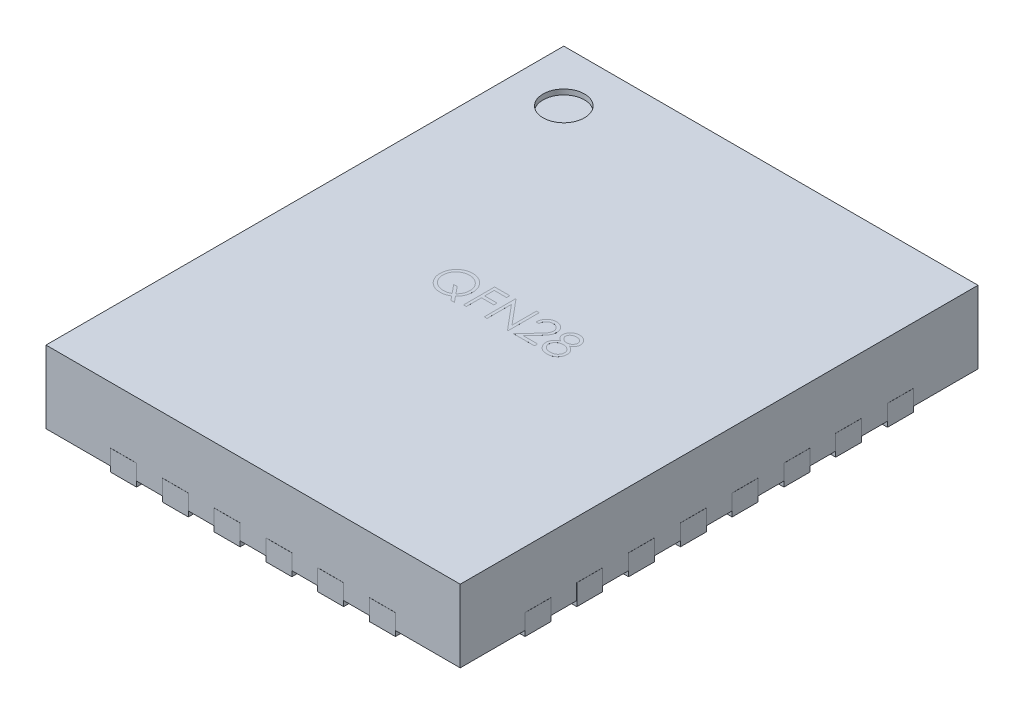
from build123d import *

# Parameters (mm, degrees)
SKETCH1_W                = 4
SKETCH1_H                = 5
BOSS_EXTRUDE1_DEPTH      = 0.7
SKETCH2_R                = 0.2
CUT_EXTRUDE1_DEPTH       = 0.05
BOSS_EXTRUDE2_DEPTH      = 0.05
BOSS_EXTRUDE2_DEPTH_BACK = 0.15
BOSS_EXTRUDE3_DEPTH      = 0.0001


with BuildPart() as part:
    # Sketch1 → Boss-Extrude1 (new body)
    with BuildSketch(Plane(origin=(0, 0, 0), x_dir=(1, 0, 0), z_dir=(0, 1, 0))):
        Rectangle(SKETCH1_W, SKETCH1_H)
    extrude(amount=BOSS_EXTRUDE1_DEPTH)

    # Sketch2 → Cut-Extrude1 (cut)
    with BuildSketch(Plane(origin=(0, 0.7, 0), x_dir=(1, 0, 0), z_dir=(0, 1, 0))):
        with Locations(Location((-1.5, 2, 0), (0, 0, 270))):
            Circle(SKETCH2_R)
    extrude(amount=-CUT_EXTRUDE1_DEPTH, mode=Mode.SUBTRACT)

    # Sketch3 → Boss-Extrude2 (add, two sides: drawn at the far end of the back side and taken through both)
    with BuildSketch(Plane.XZ.offset(-BOSS_EXTRUDE2_DEPTH_BACK)):
        Polygon((-1.325, -1.475), (-0.975, -1.825), (1.325, -1.825), (1.325, 1.825), (-1.325, 1.825), align=None)
        with BuildLine():
            Line((-1.375, 2.501), (-1.375, 2.225))
            ThreePointArc((-1.375, 2.225), (-1.338681241, 2.137318759), (-1.251, 2.101))
            Line((-1.251, 2.101), (-1.249, 2.101))
            ThreePointArc((-1.249, 2.101), (-1.161318759, 2.137318759), (-1.125, 2.225))
            Line((-1.125, 2.225), (-1.125, 2.501))
            Line((-1.125, 2.501), (-1.375, 2.501))
        make_face()
        with BuildLine():
            Line((-0.875, 2.501), (-0.875, 2.225))
            ThreePointArc((-0.875, 2.225), (-0.838681241, 2.137318759), (-0.751, 2.101))
            Line((-0.751, 2.101), (-0.749, 2.101))
            ThreePointArc((-0.749, 2.101), (-0.661318759, 2.137318759), (-0.625, 2.225))
            Line((-0.625, 2.225), (-0.625, 2.501))
            Line((-0.625, 2.501), (-0.875, 2.501))
        make_face()
        with BuildLine():
            Line((-0.375, 2.501), (-0.375, 2.225))
            ThreePointArc((-0.375, 2.225), (-0.338681241, 2.137318759), (-0.251, 2.101))
            Line((-0.251, 2.101), (-0.249, 2.101))
            ThreePointArc((-0.249, 2.101), (-0.161318759, 2.137318759), (-0.125, 2.225))
            Line((-0.125, 2.225), (-0.125, 2.501))
            Line((-0.125, 2.501), (-0.375, 2.501))
        make_face()
        with BuildLine():
            Line((0.125, 2.501), (0.125, 2.225))
            ThreePointArc((0.125, 2.225), (0.161318759, 2.137318759), (0.249, 2.101))
            Line((0.249, 2.101), (0.251, 2.101))
            ThreePointArc((0.251, 2.101), (0.338681241, 2.137318759), (0.375, 2.225))
            Line((0.375, 2.225), (0.375, 2.501))
            Line((0.375, 2.501), (0.125, 2.501))
        make_face()
        with BuildLine():
            Line((0.625, 2.501), (0.625, 2.225))
            ThreePointArc((0.625, 2.225), (0.661318759, 2.137318759), (0.749, 2.101))
            Line((0.749, 2.101), (0.751, 2.101))
            ThreePointArc((0.751, 2.101), (0.838681241, 2.137318759), (0.875, 2.225))
            Line((0.875, 2.225), (0.875, 2.501))
            Line((0.875, 2.501), (0.625, 2.501))
        make_face()
        with BuildLine():
            Line((1.125, 2.501), (1.125, 2.225))
            ThreePointArc((1.125, 2.225), (1.161318759, 2.137318759), (1.249, 2.101))
            Line((1.249, 2.101), (1.251, 2.101))
            ThreePointArc((1.251, 2.101), (1.338681241, 2.137318759), (1.375, 2.225))
            Line((1.375, 2.225), (1.375, 2.501))
            Line((1.375, 2.501), (1.125, 2.501))
        make_face()
        with BuildLine():
            Line((1.249, -2.101), (1.251, -2.101))
            ThreePointArc((1.251, -2.101), (1.338681241, -2.137318759), (1.375, -2.225))
            Line((1.375, -2.225), (1.375, -2.501))
            Line((1.375, -2.501), (1.125, -2.501))
            Line((1.125, -2.501), (1.125, -2.225))
            ThreePointArc((1.125, -2.225), (1.161318759, -2.137318759), (1.249, -2.101))
        make_face()
        with BuildLine():
            Line((0.749, -2.101), (0.751, -2.101))
            ThreePointArc((0.751, -2.101), (0.838681241, -2.137318759), (0.875, -2.225))
            Line((0.875, -2.225), (0.875, -2.501))
            Line((0.875, -2.501), (0.625, -2.501))
            Line((0.625, -2.501), (0.625, -2.225))
            ThreePointArc((0.625, -2.225), (0.661318759, -2.137318759), (0.749, -2.101))
        make_face()
        with BuildLine():
            Line((0.249, -2.101), (0.251, -2.101))
            ThreePointArc((0.251, -2.101), (0.338681241, -2.137318759), (0.375, -2.225))
            Line((0.375, -2.225), (0.375, -2.501))
            Line((0.375, -2.501), (0.125, -2.501))
            Line((0.125, -2.501), (0.125, -2.225))
            ThreePointArc((0.125, -2.225), (0.161318759, -2.137318759), (0.249, -2.101))
        make_face()
        with BuildLine():
            Line((-0.251, -2.101), (-0.249, -2.101))
            ThreePointArc((-0.249, -2.101), (-0.161318759, -2.137318759), (-0.125, -2.225))
            Line((-0.125, -2.225), (-0.125, -2.501))
            Line((-0.125, -2.501), (-0.375, -2.501))
            Line((-0.375, -2.501), (-0.375, -2.225))
            ThreePointArc((-0.375, -2.225), (-0.338681241, -2.137318759), (-0.251, -2.101))
        make_face()
        with BuildLine():
            Line((-0.751, -2.101), (-0.749, -2.101))
            ThreePointArc((-0.749, -2.101), (-0.661318759, -2.137318759), (-0.625, -2.225))
            Line((-0.625, -2.225), (-0.625, -2.501))
            Line((-0.625, -2.501), (-0.875, -2.501))
            Line((-0.875, -2.501), (-0.875, -2.225))
            ThreePointArc((-0.875, -2.225), (-0.838681241, -2.137318759), (-0.751, -2.101))
        make_face()
        with BuildLine():
            Line((-1.251, -2.101), (-1.249, -2.101))
            ThreePointArc((-1.249, -2.101), (-1.161318759, -2.137318759), (-1.125, -2.225))
            Line((-1.125, -2.225), (-1.125, -2.501))
            Line((-1.125, -2.501), (-1.375, -2.501))
            Line((-1.375, -2.501), (-1.375, -2.225))
            ThreePointArc((-1.375, -2.225), (-1.338681241, -2.137318759), (-1.251, -2.101))
        make_face()
        with BuildLine():
            Line((-2.001, -1.625), (-1.722861761, -1.625))
            ThreePointArc((-1.722861761, -1.625), (-1.636559546, -1.662066165), (-1.601, -1.749))
            Line((-1.601, -1.749), (-1.601, -1.751))
            ThreePointArc((-1.601, -1.751), (-1.637318759, -1.838681241), (-1.725, -1.875))
            Line((-1.725, -1.875), (-2.001, -1.875))
            Line((-2.001, -1.875), (-2.001, -1.625))
        make_face()
        with BuildLine():
            Line((-2.001, -1.125), (-1.722861761, -1.125))
            ThreePointArc((-1.722861761, -1.125), (-1.636559546, -1.162066165), (-1.601, -1.249))
            Line((-1.601, -1.249), (-1.601, -1.251))
            ThreePointArc((-1.601, -1.251), (-1.637318759, -1.338681241), (-1.725, -1.375))
            Line((-1.725, -1.375), (-2.001, -1.375))
            Line((-2.001, -1.375), (-2.001, -1.125))
        make_face()
        with BuildLine():
            Line((-2.001, -0.625), (-1.722861761, -0.625))
            ThreePointArc((-1.722861761, -0.625), (-1.636559546, -0.662066165), (-1.601, -0.749))
            Line((-1.601, -0.749), (-1.601, -0.751))
            ThreePointArc((-1.601, -0.751), (-1.637318759, -0.838681241), (-1.725, -0.875))
            Line((-1.725, -0.875), (-2.001, -0.875))
            Line((-2.001, -0.875), (-2.001, -0.625))
        make_face()
        with BuildLine():
            Line((-2.001, -0.125), (-1.722861761, -0.125))
            ThreePointArc((-1.722861761, -0.125), (-1.636559546, -0.162066165), (-1.601, -0.249))
            Line((-1.601, -0.249), (-1.601, -0.251))
            ThreePointArc((-1.601, -0.251), (-1.637318759, -0.338681241), (-1.725, -0.375))
            Line((-1.725, -0.375), (-2.001, -0.375))
            Line((-2.001, -0.375), (-2.001, -0.125))
        make_face()
        with BuildLine():
            Line((-2.001, 0.375), (-1.722861761, 0.375))
            ThreePointArc((-1.722861761, 0.375), (-1.636559546, 0.337933835), (-1.601, 0.251))
            Line((-1.601, 0.251), (-1.601, 0.249))
            ThreePointArc((-1.601, 0.249), (-1.637318759, 0.161318759), (-1.725, 0.125))
            Line((-1.725, 0.125), (-2.001, 0.125))
            Line((-2.001, 0.125), (-2.001, 0.375))
        make_face()
        with BuildLine():
            Line((-2.001, 0.875), (-1.722861761, 0.875))
            ThreePointArc((-1.722861761, 0.875), (-1.636559546, 0.837933835), (-1.601, 0.751))
            Line((-1.601, 0.751), (-1.601, 0.749))
            ThreePointArc((-1.601, 0.749), (-1.637318759, 0.661318759), (-1.725, 0.625))
            Line((-1.725, 0.625), (-2.001, 0.625))
            Line((-2.001, 0.625), (-2.001, 0.875))
        make_face()
        with BuildLine():
            Line((-2.001, 1.375), (-1.722861761, 1.375))
            ThreePointArc((-1.722861761, 1.375), (-1.636559546, 1.337933835), (-1.601, 1.251))
            Line((-1.601, 1.251), (-1.601, 1.249))
            ThreePointArc((-1.601, 1.249), (-1.637318759, 1.161318759), (-1.725, 1.125))
            Line((-1.725, 1.125), (-2.001, 1.125))
            Line((-2.001, 1.125), (-2.001, 1.375))
        make_face()
        with BuildLine():
            Line((-2.001, 1.875), (-1.722861761, 1.875))
            ThreePointArc((-1.722861761, 1.875), (-1.636559546, 1.837933835), (-1.601, 1.751))
            Line((-1.601, 1.751), (-1.601, 1.749))
            ThreePointArc((-1.601, 1.749), (-1.637318759, 1.661318759), (-1.725, 1.625))
            Line((-1.725, 1.625), (-2.001, 1.625))
            Line((-2.001, 1.625), (-2.001, 1.875))
        make_face()
        with BuildLine():
            Line((2.001, 1.625), (2.001, 1.875))
            Line((2.001, 1.875), (1.722861761, 1.875))
            ThreePointArc((1.722861761, 1.875), (1.636559546, 1.837933835), (1.601, 1.751))
            Line((1.601, 1.751), (1.601, 1.749))
            ThreePointArc((1.601, 1.749), (1.637318759, 1.661318759), (1.725, 1.625))
            Line((1.725, 1.625), (2.001, 1.625))
        make_face()
        with BuildLine():
            Line((2.001, 1.125), (2.001, 1.375))
            Line((2.001, 1.375), (1.722861761, 1.375))
            ThreePointArc((1.722861761, 1.375), (1.636559546, 1.337933835), (1.601, 1.251))
            Line((1.601, 1.251), (1.601, 1.249))
            ThreePointArc((1.601, 1.249), (1.637318759, 1.161318759), (1.725, 1.125))
            Line((1.725, 1.125), (2.001, 1.125))
        make_face()
        with BuildLine():
            Line((2.001, 0.625), (2.001, 0.875))
            Line((2.001, 0.875), (1.722861761, 0.875))
            ThreePointArc((1.722861761, 0.875), (1.636559546, 0.837933835), (1.601, 0.751))
            Line((1.601, 0.751), (1.601, 0.749))
            ThreePointArc((1.601, 0.749), (1.637318759, 0.661318759), (1.725, 0.625))
            Line((1.725, 0.625), (2.001, 0.625))
        make_face()
        with BuildLine():
            Line((2.001, 0.125), (2.001, 0.375))
            Line((2.001, 0.375), (1.722861761, 0.375))
            ThreePointArc((1.722861761, 0.375), (1.636559546, 0.337933835), (1.601, 0.251))
            Line((1.601, 0.251), (1.601, 0.249))
            ThreePointArc((1.601, 0.249), (1.637318759, 0.161318759), (1.725, 0.125))
            Line((1.725, 0.125), (2.001, 0.125))
        make_face()
        with BuildLine():
            Line((2.001, -0.375), (2.001, -0.125))
            Line((2.001, -0.125), (1.722861761, -0.125))
            ThreePointArc((1.722861761, -0.125), (1.636559546, -0.162066165), (1.601, -0.249))
            Line((1.601, -0.249), (1.601, -0.251))
            ThreePointArc((1.601, -0.251), (1.637318759, -0.338681241), (1.725, -0.375))
            Line((1.725, -0.375), (2.001, -0.375))
        make_face()
        with BuildLine():
            Line((2.001, -0.875), (2.001, -0.625))
            Line((2.001, -0.625), (1.722861761, -0.625))
            ThreePointArc((1.722861761, -0.625), (1.636559546, -0.662066165), (1.601, -0.749))
            Line((1.601, -0.749), (1.601, -0.751))
            ThreePointArc((1.601, -0.751), (1.637318759, -0.838681241), (1.725, -0.875))
            Line((1.725, -0.875), (2.001, -0.875))
        make_face()
        with BuildLine():
            Line((2.001, -1.375), (2.001, -1.125))
            Line((2.001, -1.125), (1.722861761, -1.125))
            ThreePointArc((1.722861761, -1.125), (1.636559546, -1.162066165), (1.601, -1.249))
            Line((1.601, -1.249), (1.601, -1.251))
            ThreePointArc((1.601, -1.251), (1.637318759, -1.338681241), (1.725, -1.375))
            Line((1.725, -1.375), (2.001, -1.375))
        make_face()
        with BuildLine():
            Line((2.001, -1.875), (2.001, -1.625))
            Line((2.001, -1.625), (1.722861761, -1.625))
            ThreePointArc((1.722861761, -1.625), (1.636559546, -1.662066165), (1.601, -1.749))
            Line((1.601, -1.749), (1.601, -1.751))
            ThreePointArc((1.601, -1.751), (1.637318759, -1.838681241), (1.725, -1.875))
            Line((1.725, -1.875), (2.001, -1.875))
        make_face()
    extrude(amount=BOSS_EXTRUDE2_DEPTH + BOSS_EXTRUDE2_DEPTH_BACK)

    # Sketch4 → Boss-Extrude3 (add)
    # profile 1 of 5: a face of its own
    with BuildSketch(Plane(origin=(0, 0.7, 0), x_dir=(1, 0, 0), z_dir=(0, 1, 0))):
        with BuildLine():
            Line((-0.431084232, -0.114831524), (-0.384990482, -0.171321908))
            Line((-0.384990482, -0.171321908), (-0.418584232, -0.171321908))
            Line((-0.418584232, -0.171321908), (-0.451877501, -0.130576716))
            add(Edge.make_bspline(
                [(-0.451877501, -0.130576716), (-0.45521668, -0.132605893), (-0.461833529, -0.136626869), (-0.472150669, -0.141809683), (-0.482672981, -0.146122461), (-0.493377181, -0.149685602), (-0.50424768, -0.152537687), (-0.515339601, -0.154517154), (-0.526612713, -0.155666606), (-0.534186633, -0.15584672), (-0.537995289, -0.155937293)],
                knots=[0, 0, 0, 0, 1.030216282, 2.041455142, 3.041201647, 4.026904037, 5.014869161, 6.002481075, 6.995518502, 8, 8, 8, 8], degree=3))
            add(Edge.make_bspline(
                [(-0.537995289, -0.155937293), (-0.54345189, -0.155805863), (-0.554188856, -0.155547249), (-0.569957723, -0.153289495), (-0.585093462, -0.149802594), (-0.599565903, -0.144757394), (-0.613390813, -0.138313181), (-0.626561768, -0.130368386), (-0.639085462, -0.121033053), (-0.650777027, -0.110368192), (-0.661467777, -0.098766309), (-0.67084824, -0.08637022), (-0.678824168, -0.073385623), (-0.685273181, -0.059747769), (-0.690391335, -0.045575385), (-0.693879218, -0.030750602), (-0.696136884, -0.015361672), (-0.696396973, -0.004883686), (-0.696528943, 0.000432899)],
                knots=[0, 0, 0, 0, 1.055750571, 2.07740284, 3.077223765, 4.05828044, 5.038417088, 6.02463293, 7.030503776, 8.057169806, 9.083586829, 10.080154041, 11.061747002, 12.027853603, 12.995569715, 13.972756451, 14.971366004, 16, 16, 16, 16], degree=3))
            add(Edge.make_bspline(
                [(-0.696528943, 0.000432899), (-0.69648199, 0.004001295), (-0.696388412, 0.011113015), (-0.695305914, 0.021646202), (-0.693697589, 0.032005984), (-0.691422676, 0.042149312), (-0.688444624, 0.052117762), (-0.684874249, 0.061891677), (-0.680548263, 0.071445872), (-0.675657842, 0.080760792), (-0.670203619, 0.089755706), (-0.66426221, 0.098302591), (-0.657818999, 0.106317218), (-0.650878547, 0.113795918), (-0.643468572, 0.120755224), (-0.635652794, 0.127309736), (-0.627264564, 0.133215617), (-0.618525275, 0.13870785), (-0.609385917, 0.143537508), (-0.600025256, 0.147855068), (-0.590373268, 0.151358224), (-0.58055519, 0.154343337), (-0.570511457, 0.156622301), (-0.560249895, 0.158218836), (-0.549777724, 0.159311776), (-0.54270564, 0.159401864), (-0.539137116, 0.159447322)],
                knots=[0, 0, 0, 0, 1.030721839, 2.054201982, 3.056261636, 4.058906239, 5.055198403, 6.060579377, 7.06322398, 8.083343201, 9.098870418, 10.10084648, 11.0888991, 12.067804703, 13.046436456, 14.024708667, 15.012489976, 16.008294399, 17.005242112, 17.997338632, 18.984424362, 19.969624474, 20.960977749, 21.957320355, 22.969278161, 24, 24, 24, 24], degree=3))
            add(Edge.make_bspline(
                [(-0.539137116, 0.159447322), (-0.533680495, 0.159316552), (-0.522963342, 0.159059712), (-0.50723354, 0.156801618), (-0.49214239, 0.153300724), (-0.477700637, 0.148281236), (-0.463921155, 0.141820794), (-0.450809735, 0.133877601), (-0.438346048, 0.12454165), (-0.426715575, 0.113876074), (-0.416050004, 0.102245602), (-0.406714038, 0.089781917), (-0.398770898, 0.076670489), (-0.392310258, 0.062891034), (-0.387291516, 0.048449182), (-0.383783279, 0.033339054), (-0.381535967, 0.017587604), (-0.381276295, 0.006850904), (-0.381144328, 0.001394438)],
                knots=[0, 0, 0, 0, 1.050672203, 2.063587442, 3.054842799, 4.031180399, 5.003107577, 5.981273811, 6.979214548, 7.998088659, 9.016962771, 10.014903508, 10.993069742, 11.96499692, 12.941334519, 13.932589877, 14.949327797, 16, 16, 16, 16], degree=3))
            add(Edge.make_bspline(
                [(-0.381144328, 0.001394438), (-0.381288552, -0.004283051), (-0.381572161, -0.015447511), (-0.383985724, -0.031819001), (-0.387866308, -0.047457632), (-0.393369446, -0.062353155), (-0.400483759, -0.076502864), (-0.409071805, -0.090048257), (-0.419236984, -0.102988373), (-0.42709356, -0.110842232), (-0.431084232, -0.114831524)],
                knots=[0, 0, 0, 0, 1.045660934, 2.056233022, 3.041853582, 4.009978652, 4.97562384, 5.954545411, 6.961031197, 8, 8, 8, 8], degree=3))
        make_face()
        with BuildLine():
            add(Edge.make_bspline(
                [(-0.449173174, -0.092656043), (-0.445899859, -0.089331788), (-0.439461102, -0.082792832), (-0.431106942, -0.072069289), (-0.423921526, -0.060922383), (-0.418168818, -0.049203834), (-0.413591755, -0.037060459), (-0.410429507, -0.024396038), (-0.4084495, -0.011268224), (-0.408195706, -0.002338565), (-0.408067405, 0.002175688)],
                knots=[0, 0, 0, 0, 1.052210109, 2.069743939, 3.061837814, 4.040478349, 5.010453814, 5.985306305, 6.981502329, 8, 8, 8, 8], degree=3))
            add(Edge.make_bspline(
                [(-0.408067405, 0.002175688), (-0.408100928, 0.005082811), (-0.408167198, 0.01082968), (-0.409078403, 0.019334039), (-0.410367487, 0.027650567), (-0.412233685, 0.035764407), (-0.41463689, 0.043659118), (-0.41760506, 0.051323984), (-0.421080363, 0.058783733), (-0.425131808, 0.065992023), (-0.429598183, 0.072938409), (-0.434569806, 0.079537938), (-0.439976699, 0.085756583), (-0.445759794, 0.091696822), (-0.45203059, 0.097236207), (-0.458766595, 0.102372362), (-0.465884809, 0.107229581), (-0.473420454, 0.111613848), (-0.481185935, 0.115644498), (-0.489135811, 0.119134791), (-0.497203331, 0.122090944), (-0.505376001, 0.124488004), (-0.513643247, 0.126374796), (-0.522019561, 0.127662438), (-0.530483283, 0.128572704), (-0.536169952, 0.128642933), (-0.539016924, 0.128678092)],
                knots=[0, 0, 0, 0, 1.032958288, 2.041976502, 3.037103433, 4.023477888, 4.998866292, 5.968231228, 6.943073582, 7.921783703, 8.90545537, 9.876780072, 10.85618943, 11.833110341, 12.821898168, 13.827467856, 14.842673888, 15.88323808, 16.924703457, 17.951432745, 18.967462636, 19.976958182, 20.977218729, 21.979378626, 22.98839684, 24, 24, 24, 24], degree=3))
            add(Edge.make_bspline(
                [(-0.539016924, 0.128678092), (-0.541883875, 0.128642687), (-0.547610413, 0.12857197), (-0.556114997, 0.127667472), (-0.564510535, 0.126373379), (-0.572760102, 0.124495964), (-0.580892913, 0.122094242), (-0.588883723, 0.119120217), (-0.596802026, 0.115716133), (-0.604483509, 0.111688057), (-0.611914733, 0.10726609), (-0.618982296, 0.102457167), (-0.625589344, 0.097213311), (-0.631798551, 0.091618947), (-0.637594407, 0.085630911), (-0.643004279, 0.079289033), (-0.647933159, 0.072519731), (-0.65244894, 0.065444116), (-0.656440202, 0.058054501), (-0.660039813, 0.050484213), (-0.662963497, 0.042649789), (-0.66536378, 0.034613938), (-0.667325174, 0.026396636), (-0.668589369, 0.017950182), (-0.669507409, 0.009327304), (-0.669572795, 0.003500348), (-0.669605866, 0.000553092)],
                knots=[0, 0, 0, 0, 1.013205451, 2.023808328, 3.020541854, 4.015386314, 5.012622987, 6.016502547, 7.02834558, 8.057881235, 9.080621846, 10.084476421, 11.077781791, 12.060654405, 13.037357686, 14.022218736, 15.005346502, 15.995617173, 16.98763393, 17.973029642, 18.956998942, 19.940662314, 20.93709383, 21.940823471, 22.958474994, 24, 24, 24, 24], degree=3))
            add(Edge.make_bspline(
                [(-0.669605866, 0.000553092), (-0.669493276, -0.003780015), (-0.669271775, -0.012304576), (-0.667435592, -0.024820104), (-0.664356999, -0.036801803), (-0.66004992, -0.048266815), (-0.654642974, -0.059281223), (-0.647919027, -0.069737121), (-0.639906766, -0.079594686), (-0.630909298, -0.088921624), (-0.621011949, -0.097371456), (-0.6105198, -0.104808232), (-0.599522429, -0.111117677), (-0.587985303, -0.116210135), (-0.575994454, -0.120299551), (-0.563455229, -0.123068168), (-0.550449594, -0.124903281), (-0.541587474, -0.125078975), (-0.537093847, -0.125168062)],
                knots=[0, 0, 0, 0, 1.022526523, 2.011626, 2.97850031, 3.937665323, 4.897797383, 5.869804095, 6.865337375, 7.89202157, 8.925035373, 9.93268082, 10.923937058, 11.912550332, 12.905497077, 13.90928476, 14.939882052, 16, 16, 16, 16], degree=3))
            add(Edge.make_bspline(
                [(-0.537093847, -0.125168062), (-0.534006555, -0.12513443), (-0.52790011, -0.125067909), (-0.518895481, -0.124160999), (-0.510111205, -0.122884504), (-0.501628626, -0.120943081), (-0.493374186, -0.118529464), (-0.48539702, -0.115593518), (-0.477654811, -0.112112929), (-0.472731976, -0.109359373), (-0.470266924, -0.107980562)],
                knots=[0, 0, 0, 0, 1.060694673, 2.097979151, 3.107774411, 4.11000626, 5.086069662, 6.061987343, 7.029562652, 8, 8, 8, 8], degree=3))
            Line((-0.470266924, -0.107980562), (-0.537815001, -0.025168062))
            Line((-0.537815001, -0.025168062), (-0.504221251, -0.025168062))
            Line((-0.504221251, -0.025168062), (-0.449173174, -0.092656043))
        make_face(mode=Mode.SUBTRACT)
    # profile 2 of 5: a face of its own
    with BuildSketch(Plane(origin=(0, 0.7, 0), x_dir=(1, 0, 0), z_dir=(0, 1, 0))):
        Polygon((-0.319605866, 0.151755015), (-0.17345202, 0.151755015), (-0.17345202, 0.120985784), (-0.292682789, 0.120985784), (-0.292682789, 0.028678092), (-0.17345202, 0.028678092), (-0.17345202, -0.002091139), (-0.292682789, -0.002091139), (-0.292682789, -0.148244985), (-0.319605866, -0.148244985), align=None)
    # profile 3 of 5: a face of its own
    with BuildSketch(Plane(origin=(0, 0.7, 0), x_dir=(1, 0, 0), z_dir=(0, 1, 0))):
        Polygon((-0.119605866, -0.148244985), (-0.119605866, 0.151755015), (-0.113956828, 0.151755015), (0.084240287, -0.084362774), (0.084240287, 0.151755015), (0.111163364, 0.151755015), (0.111163364, -0.148244985), (0.105033557, -0.148244985), (-0.092682789, 0.087331938), (-0.092682789, -0.148244985), align=None)
    # profile 4 of 5: a face of its own
    with BuildSketch(Plane(origin=(0, 0.7, 0), x_dir=(1, 0, 0), z_dir=(0, 1, 0))):
        with BuildLine():
            Line((0.199624903, 0.059447322), (0.172701826, 0.059447322))
            add(Edge.make_bspline(
                [(0.172701826, 0.059447322), (0.172877296, 0.063019113), (0.173221915, 0.070034014), (0.174835768, 0.080261777), (0.177144987, 0.090037903), (0.180409968, 0.099283896), (0.184464792, 0.108081508), (0.189327366, 0.116395795), (0.195086839, 0.124195039), (0.201618845, 0.13140694), (0.208713299, 0.138023018), (0.216368094, 0.143736324), (0.224411954, 0.148563553), (0.232820474, 0.152599088), (0.241688522, 0.155628218), (0.250935624, 0.157875787), (0.260602407, 0.159228045), (0.267188695, 0.159373398), (0.270538364, 0.159447322)],
                knots=[0, 0, 0, 0, 1.10065271, 2.161652631, 3.183658789, 4.190468796, 5.17591951, 6.163126047, 7.15150782, 8.156236427, 9.156009102, 10.134482811, 11.092018607, 12.041330605, 13.001268258, 13.972401359, 14.968799086, 16, 16, 16, 16], degree=3))
            add(Edge.make_bspline(
                [(0.270538364, 0.159447322), (0.273827914, 0.159370312), (0.28029176, 0.159218989), (0.289725647, 0.157919472), (0.298706558, 0.155884136), (0.307216938, 0.153028528), (0.315188887, 0.149189863), (0.32268229, 0.144578646), (0.32978636, 0.139245517), (0.336181227, 0.132966619), (0.342053348, 0.126263557), (0.347119256, 0.119107451), (0.351457527, 0.11171637), (0.355073614, 0.104033953), (0.357735568, 0.095987864), (0.359756558, 0.087695247), (0.360898907, 0.079070263), (0.361074229, 0.073232558), (0.361163364, 0.07026463)],
                knots=[0, 0, 0, 0, 1.111607364, 2.184268762, 3.212621178, 4.221274766, 5.211760367, 6.196651075, 7.1921475, 8.207485113, 9.220403448, 10.201281604, 11.166441695, 12.114753415, 13.065576456, 14.026450734, 14.996634279, 16, 16, 16, 16], degree=3))
            add(Edge.make_bspline(
                [(0.361163364, 0.07026463), (0.361018228, 0.066086244), (0.360730501, 0.057802797), (0.358269269, 0.045630095), (0.354425282, 0.033836373), (0.349796937, 0.024344604), (0.34512787, 0.016696019), (0.34092037, 0.010398702), (0.335994815, 0.003618233), (0.330279515, -0.003622682), (0.323892697, -0.011380759), (0.316776512, -0.019651313), (0.308880213, -0.028348893), (0.303338056, -0.034289374), (0.300466249, -0.037367582)],
                knots=[0, 0, 0, 0, 1.184426356, 2.348067706, 3.509069118, 4.696110526, 5.333549288, 6.050745305, 6.844228056, 7.710549037, 8.667450064, 9.695053472, 10.805634456, 12, 12, 12, 12], degree=3))
            Line((0.300466249, -0.037367582), (0.225406153, -0.117475755))
            Line((0.225406153, -0.117475755), (0.365009518, -0.117475755))
            Line((0.365009518, -0.117475755), (0.365009518, -0.148244985))
            Line((0.365009518, -0.148244985), (0.161163364, -0.148244985))
            Line((0.161163364, -0.148244985), (0.277509518, -0.024086332))
            add(Edge.make_bspline(
                [(0.277509518, -0.024086332), (0.280342194, -0.021129334), (0.285783185, -0.015449546), (0.293478835, -0.007157293), (0.300390748, 0.000535525), (0.306563667, 0.007614372), (0.311863682, 0.014182792), (0.316567016, 0.020028053), (0.320335495, 0.025407005), (0.324425386, 0.031641915), (0.328386585, 0.0392544), (0.331790501, 0.048557287), (0.33386606, 0.058133909), (0.334115045, 0.064605512), (0.334240287, 0.067860784)],
                knots=[0, 0, 0, 0, 1.329631726, 2.553950428, 3.673215718, 4.687767853, 5.603093632, 6.413772471, 7.123043292, 7.734684054, 8.834405432, 9.900288307, 10.943827018, 12, 12, 12, 12], degree=3))
            add(Edge.make_bspline(
                [(0.334240287, 0.067860784), (0.334185795, 0.069907761), (0.334078402, 0.073941959), (0.333130599, 0.079856739), (0.33169827, 0.085562294), (0.329645819, 0.091076176), (0.32693667, 0.096342946), (0.323638952, 0.101369016), (0.319834089, 0.10622807), (0.315432552, 0.110784067), (0.310597279, 0.114956742), (0.3054892, 0.118653092), (0.300084905, 0.121742159), (0.294407181, 0.124274458), (0.288471855, 0.12626092), (0.282267448, 0.127637369), (0.275811104, 0.128501582), (0.271402518, 0.128618511), (0.269156153, 0.128678092)],
                knots=[0, 0, 0, 0, 0.991446411, 1.95395049, 2.89581595, 3.838931463, 4.798493298, 5.75982156, 6.748411868, 7.785213223, 8.824556874, 9.840280684, 10.836137867, 11.835679398, 12.848801643, 13.863922112, 14.911575587, 16, 16, 16, 16], degree=3))
            add(Edge.make_bspline(
                [(0.269156153, 0.128678092), (0.266810081, 0.128616803), (0.262202785, 0.128496443), (0.255438296, 0.1276545), (0.248985229, 0.126201999), (0.242827352, 0.124215427), (0.236954245, 0.121690409), (0.23139447, 0.118545402), (0.226160508, 0.114792531), (0.22124252, 0.110537626), (0.216711322, 0.105800404), (0.212730161, 0.10051955), (0.209251531, 0.094791485), (0.206216454, 0.088631667), (0.20375168, 0.0819842), (0.201868268, 0.074872682), (0.200377966, 0.067327993), (0.199880093, 0.062117842), (0.199624903, 0.059447322)],
                knots=[0, 0, 0, 0, 1.031018746, 2.02475058, 2.990194455, 3.934040569, 4.864654155, 5.795059489, 6.735614925, 7.690564532, 8.649604399, 9.611025574, 10.590972636, 11.591080095, 12.624614302, 13.701020113, 14.821632451, 16, 16, 16, 16], degree=3))
        make_face()
    # profile 5 of 5: a face of its own
    with BuildSketch(Plane(origin=(0, 0.7, 0), x_dir=(1, 0, 0), z_dir=(0, 1, 0))):
        with BuildLine():
            add(Edge.make_bspline(
                [(0.537785961, 0.018882418), (0.54024155, 0.017602022), (0.54503077, 0.015104822), (0.551851674, 0.011083894), (0.558085245, 0.006846097), (0.563904437, 0.002591595), (0.569207009, -0.001842547), (0.573933673, -0.00647396), (0.578201184, -0.011187041), (0.581923479, -0.016061599), (0.585197494, -0.021084683), (0.588027106, -0.026269478), (0.590445723, -0.031604621), (0.592362546, -0.037148349), (0.593941557, -0.042819229), (0.595028037, -0.048690484), (0.595612345, -0.054723428), (0.595722814, -0.058800711), (0.595778749, -0.060865178)],
                knots=[0, 0, 0, 0, 1.272397273, 2.481599622, 3.635517121, 4.734568067, 5.792894095, 6.808321871, 7.773003508, 8.711915296, 9.623354172, 10.525449501, 11.423591555, 12.311487226, 13.218079475, 14.126165749, 15.051214107, 16, 16, 16, 16], degree=3))
            add(Edge.make_bspline(
                [(0.595778749, -0.060865178), (0.595712627, -0.063753555), (0.595581747, -0.069470737), (0.594441749, -0.077908975), (0.592734922, -0.08610427), (0.590242392, -0.094054827), (0.587009816, -0.101716773), (0.583026087, -0.109096668), (0.578516555, -0.116315466), (0.574894935, -0.120757129), (0.573062403, -0.123004601)],
                knots=[0, 0, 0, 0, 1.025265484, 2.029385089, 3.018602448, 3.995076438, 4.983346944, 5.966715145, 6.97116228, 8, 8, 8, 8], degree=3))
            add(Edge.make_bspline(
                [(0.573062403, -0.123004601), (0.570676419, -0.125626924), (0.565933937, -0.130839166), (0.557809686, -0.137606379), (0.548893524, -0.14329347), (0.539219953, -0.147928203), (0.52881483, -0.151535563), (0.517680372, -0.154127779), (0.505794873, -0.155612558), (0.497625833, -0.155827186), (0.493434999, -0.155937293)],
                knots=[0, 0, 0, 0, 0.954267603, 1.896743057, 2.838368354, 3.796610408, 4.779680527, 5.799409237, 6.871065594, 8, 8, 8, 8], degree=3))
            add(Edge.make_bspline(
                [(0.493434999, -0.155937293), (0.48940528, -0.155838509), (0.481563856, -0.155646286), (0.470150324, -0.154343906), (0.459511203, -0.152061518), (0.449584635, -0.148937694), (0.440430461, -0.14487396), (0.432074767, -0.139816096), (0.424396998, -0.133967687), (0.417630157, -0.127160766), (0.411622576, -0.119870091), (0.406345314, -0.112348525), (0.401958965, -0.10459538), (0.398245214, -0.096726263), (0.39540224, -0.088630878), (0.393433194, -0.080350877), (0.392182681, -0.071900722), (0.392016298, -0.066198009), (0.391932595, -0.06332912)],
                knots=[0, 0, 0, 0, 1.256902934, 2.445805442, 3.576955095, 4.645999104, 5.686449165, 6.692658513, 7.68621702, 8.689161843, 9.678783111, 10.630372946, 11.551080876, 12.453998257, 13.34127905, 14.221779781, 15.105423033, 16, 16, 16, 16], degree=3))
            add(Edge.make_bspline(
                [(0.391932595, -0.06332912), (0.391982128, -0.061224046), (0.392080022, -0.057063678), (0.39275758, -0.050917164), (0.393846877, -0.044934638), (0.395326259, -0.039094003), (0.397331204, -0.03343778), (0.399751958, -0.027939168), (0.402574697, -0.022591959), (0.405838797, -0.017366912), (0.409636113, -0.01233724), (0.413935855, -0.007417583), (0.418823958, -0.00268428), (0.424246043, 0.001920499), (0.430140146, 0.00647844), (0.436659363, 0.010743216), (0.443630872, 0.015016756), (0.448585621, 0.017571756), (0.451127307, 0.018882418)],
                knots=[0, 0, 0, 0, 0.941657376, 1.861047343, 2.762797495, 3.66048619, 4.553285746, 5.444104102, 6.34607688, 7.256116206, 8.197091036, 9.162375105, 10.176350973, 11.237807142, 12.343728897, 13.50695164, 14.721116704, 16, 16, 16, 16], degree=3))
            add(Edge.make_bspline(
                [(0.451127307, 0.018882418), (0.447648046, 0.020779684), (0.440911223, 0.024453322), (0.431990986, 0.031203048), (0.424328932, 0.038513433), (0.418135671, 0.046538844), (0.413260908, 0.055028576), (0.409916456, 0.063929512), (0.407653901, 0.073076607), (0.407429773, 0.07932571), (0.407317211, 0.082464149)],
                knots=[0, 0, 0, 0, 1.166880483, 2.259407225, 3.286803203, 4.280235371, 5.237608625, 6.161067461, 7.076446754, 8, 8, 8, 8], degree=3))
            add(Edge.make_bspline(
                [(0.407317211, 0.082464149), (0.40745739, 0.085661083), (0.407739174, 0.092087477), (0.410017745, 0.101653716), (0.413730893, 0.111049422), (0.418781264, 0.120229054), (0.425071597, 0.12888193), (0.432618444, 0.136642582), (0.441241584, 0.143440709), (0.450897972, 0.149147238), (0.46128965, 0.153791552), (0.472253855, 0.156995417), (0.483599554, 0.159089941), (0.491322216, 0.159327083), (0.495237884, 0.159447322)],
                knots=[0, 0, 0, 0, 0.888701115, 1.786444228, 2.72001202, 3.692817113, 4.693886446, 5.687152267, 6.695133018, 7.739871481, 8.800368666, 9.853104506, 10.91144658, 12, 12, 12, 12], degree=3))
            add(Edge.make_bspline(
                [(0.495237884, 0.159447322), (0.499052496, 0.15932335), (0.506574478, 0.159078891), (0.51763116, 0.157040016), (0.528210436, 0.153634628), (0.538275821, 0.149014866), (0.547647124, 0.143324557), (0.555927322, 0.136433054), (0.563241543, 0.128706635), (0.569291634, 0.120056383), (0.574277025, 0.110912024), (0.577748531, 0.101344379), (0.579972986, 0.091560174), (0.58025356, 0.084939774), (0.580394134, 0.081622803)],
                knots=[0, 0, 0, 0, 1.072916533, 2.115669174, 3.151510826, 4.193348718, 5.225979165, 6.227137561, 7.216255879, 8.211077061, 9.189680878, 10.138522389, 11.067357538, 12, 12, 12, 12], degree=3))
            add(Edge.make_bspline(
                [(0.580394134, 0.081622803), (0.580271171, 0.07836766), (0.58002968, 0.071974745), (0.577998257, 0.062655329), (0.574577116, 0.053927726), (0.569906187, 0.045692902), (0.563818288, 0.038100202), (0.556394683, 0.031053076), (0.547694556, 0.024493633), (0.541157909, 0.020791945), (0.537785961, 0.018882418)],
                knots=[0, 0, 0, 0, 0.975232327, 1.915300861, 2.843280834, 3.77672583, 4.742871857, 5.749627742, 6.839139064, 8, 8, 8, 8], degree=3))
        make_face()
        with BuildLine():
            add(Edge.make_bspline(
                [(0.49373548, 0.128678092), (0.491631125, 0.128622254), (0.487514087, 0.128513011), (0.481477344, 0.12794227), (0.475736855, 0.126831995), (0.470232644, 0.125354391), (0.465040174, 0.123358278), (0.460088926, 0.121010134), (0.455463167, 0.118155328), (0.451107056, 0.11495294), (0.447185561, 0.111430691), (0.44370517, 0.107760944), (0.440814189, 0.103871624), (0.438359237, 0.099859479), (0.436577964, 0.09560543), (0.435243881, 0.0912399), (0.434342047, 0.086707724), (0.434274471, 0.083610309), (0.434240287, 0.082043476)],
                knots=[0, 0, 0, 0, 1.203892937, 2.355340988, 3.463153438, 4.544400666, 5.610487187, 6.640501085, 7.674077295, 8.714426146, 9.728707835, 10.68524104, 11.601827946, 12.495867327, 13.368432065, 14.231010473, 15.105153427, 16, 16, 16, 16], degree=3))
            add(Edge.make_bspline(
                [(0.434240287, 0.082043476), (0.434299205, 0.080476575), (0.434415633, 0.077380154), (0.435316073, 0.072807651), (0.436658089, 0.068314368), (0.438771003, 0.064007147), (0.441305262, 0.059736574), (0.444433103, 0.055609381), (0.448160734, 0.051611205), (0.452363086, 0.047776053), (0.456941218, 0.04418473), (0.461791279, 0.041067029), (0.466852398, 0.038458391), (0.472072575, 0.036287299), (0.477505014, 0.03459959), (0.483116426, 0.033402278), (0.488907754, 0.032658106), (0.492831804, 0.032569219), (0.494817211, 0.032524245)],
                knots=[0, 0, 0, 0, 0.873023192, 1.725219244, 2.590779336, 3.480155217, 4.391973325, 5.357036234, 6.360879153, 7.436073238, 8.526419356, 9.601555421, 10.645666583, 11.697338044, 12.750135903, 13.812665442, 14.89329948, 16, 16, 16, 16], degree=3))
            add(Edge.make_bspline(
                [(0.494817211, 0.032524245), (0.497367219, 0.032599063), (0.502442051, 0.032747958), (0.509923137, 0.034132344), (0.517197077, 0.036309994), (0.524186126, 0.03928942), (0.530709377, 0.043028951), (0.53652424, 0.047506067), (0.541581116, 0.052617389), (0.545827454, 0.058283347), (0.549119727, 0.064313483), (0.551682739, 0.070364937), (0.553179414, 0.076502271), (0.553374634, 0.080613725), (0.553471057, 0.082644438)],
                knots=[0, 0, 0, 0, 1.076279235, 2.141928126, 3.20205304, 4.278698113, 5.344010996, 6.36967002, 7.368914609, 8.37248503, 9.349703398, 10.264243087, 11.142681841, 12, 12, 12, 12], degree=3))
            add(Edge.make_bspline(
                [(0.553471057, 0.082644438), (0.553425465, 0.084069698), (0.553334973, 0.086898635), (0.552589254, 0.091076209), (0.55135704, 0.095158745), (0.549688776, 0.099179968), (0.547493651, 0.10308346), (0.544891006, 0.106930581), (0.541729477, 0.11063479), (0.538181212, 0.114282408), (0.53415732, 0.117658182), (0.529665556, 0.120626871), (0.524728949, 0.12314793), (0.519347381, 0.125195538), (0.513540674, 0.126733454), (0.50733557, 0.12788514), (0.500680332, 0.128534264), (0.496100639, 0.128629109), (0.49373548, 0.128678092)],
                knots=[0, 0, 0, 0, 0.814439003, 1.616544685, 2.417341072, 3.248991801, 4.09997495, 4.973547432, 5.9003056, 6.880240646, 7.880314356, 8.896779544, 9.951930927, 11.043077905, 12.18215768, 13.381699519, 14.647792085, 16, 16, 16, 16], degree=3))
        make_face(mode=Mode.SUBTRACT)
        with BuildLine():
            add(Edge.make_bspline(
                [(0.495478268, 0.001755015), (0.492810344, 0.00170756), (0.487576527, 0.001614465), (0.47990879, 0.000578222), (0.472549947, -0.000864298), (0.46552481, -0.003052655), (0.458836345, -0.005898069), (0.452448343, -0.009321029), (0.446409675, -0.01336721), (0.440803727, -0.017985206), (0.435684584, -0.02296173), (0.431193302, -0.028229913), (0.427379228, -0.033691845), (0.424307807, -0.039416893), (0.421786801, -0.045283831), (0.420131326, -0.051438768), (0.419070037, -0.057763378), (0.418927525, -0.062062815), (0.418855672, -0.064230562)],
                knots=[0, 0, 0, 0, 1.140299081, 2.23698856, 3.303958914, 4.344563908, 5.37730929, 6.408454204, 7.439741482, 8.480804886, 9.510774543, 10.48932336, 11.43758569, 12.353841022, 13.263987381, 14.161954604, 15.073269652, 16, 16, 16, 16], degree=3))
            add(Edge.make_bspline(
                [(0.418855672, -0.064230562), (0.418972523, -0.06692464), (0.419204352, -0.072269627), (0.421043492, -0.080169319), (0.42399511, -0.087816838), (0.428111557, -0.095149862), (0.433208777, -0.102002729), (0.43947676, -0.107976052), (0.446525975, -0.113283608), (0.454594934, -0.117576225), (0.463408802, -0.121004355), (0.472965236, -0.123366295), (0.483127087, -0.124929848), (0.490143623, -0.125087406), (0.49373548, -0.125168062)],
                knots=[0, 0, 0, 0, 0.898778495, 1.783155532, 2.693654817, 3.627872908, 4.583023416, 5.533784346, 6.509005473, 7.520592997, 8.575161974, 9.658835044, 10.801527049, 12, 12, 12, 12], degree=3))
            add(Edge.make_bspline(
                [(0.49373548, -0.125168062), (0.496542654, -0.125114164), (0.50201193, -0.125009154), (0.509990726, -0.124082215), (0.517520258, -0.122612247), (0.524585927, -0.120474229), (0.531266827, -0.117864231), (0.537449686, -0.114506624), (0.54329356, -0.110687853), (0.548510485, -0.106157154), (0.553261903, -0.101316054), (0.557404756, -0.096191193), (0.561001118, -0.090921854), (0.563823771, -0.085388955), (0.566080307, -0.079698648), (0.567702326, -0.073798461), (0.568703145, -0.067670298), (0.568804364, -0.063513235), (0.568855672, -0.061406043)],
                knots=[0, 0, 0, 0, 1.224942928, 2.386581632, 3.501229538, 4.569074225, 5.605009692, 6.626002462, 7.634866581, 8.645888296, 9.63523824, 10.59253846, 11.518950513, 12.414518923, 13.29783783, 14.186679152, 15.080837789, 16, 16, 16, 16], degree=3))
            add(Edge.make_bspline(
                [(0.568855672, -0.061406043), (0.568778028, -0.059359414), (0.568624927, -0.055323819), (0.567653211, -0.049343831), (0.565946136, -0.043566447), (0.563603787, -0.03792216), (0.560485419, -0.032525336), (0.556813002, -0.027235378), (0.552382077, -0.022199112), (0.547375283, -0.017377418), (0.541918801, -0.012918926), (0.53611876, -0.008974831), (0.530019806, -0.005653221), (0.523634845, -0.002951807), (0.516978055, -0.000827167), (0.510054331, 0.000657061), (0.502855567, 0.001591313), (0.49796515, 0.001699831), (0.495478268, 0.001755015)],
                knots=[0, 0, 0, 0, 0.917430815, 1.809013306, 2.70690318, 3.612392954, 4.541220862, 5.495268465, 6.494511384, 7.542276156, 8.608045339, 9.649016899, 10.681629292, 11.715607085, 12.752076957, 13.808767841, 14.885711793, 16, 16, 16, 16], degree=3))
        make_face(mode=Mode.SUBTRACT)
    extrude(amount=BOSS_EXTRUDE3_DEPTH)


solid = part.part
